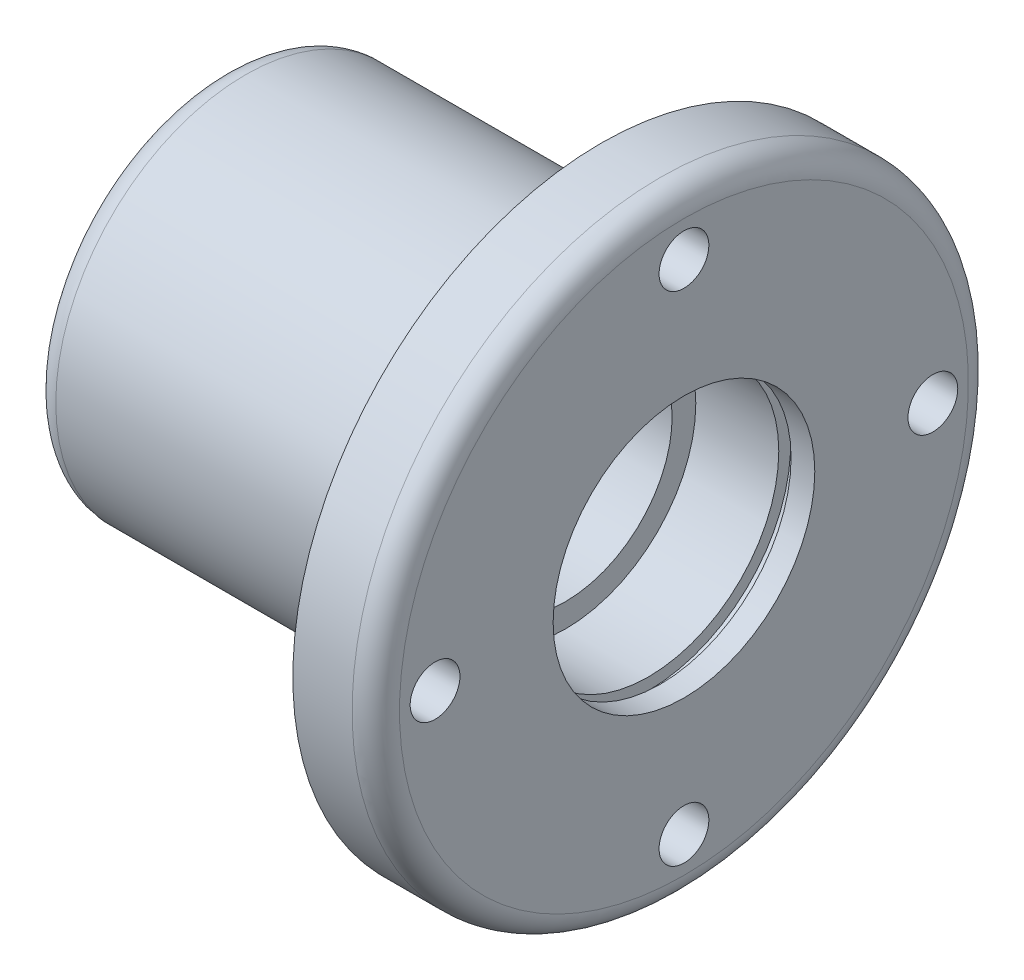
from build123d import *

# Parameters (mm, degrees)
SKETCH2_R          = 2.1
CUT_EXTRUDE1_DEPTH = 54.600373133
FILLET1_R          = 2


with BuildPart() as part:
    # Sketch1 → Revolve1 (revolve)
    with BuildSketch(Plane.XY, mode=Mode.PRIVATE) as revolve1_sk:
        Polygon((-70.7, 11), (-68.7, 11), (-68.7, 12), (-67.7, 12), (-67.7, 11), (-60.7, 11), (-60.7, 9), (-41.7, 9), (-41.7, 11), (-34.7, 11), (-34.7, 12), (-33.7, 12), (-33.7, 11.038518603), (-31.7, 11.038518603), (-31.7, 26), (-38.7, 26), (-38.7, 16), (-70.7, 16), align=None)
    revolve(revolve1_sk.sketch.rotate(Axis((-70.7, 0, 0), (1, 0, 0)), 180), axis=Axis((-70.7, 0, 0), (1, 0, 0)))

    # Sketch2 → Cut-Extrude1 (cut, through all)
    with BuildSketch(Plane(origin=(-31.7, 0, 0), x_dir=(0, 0, -1), z_dir=(1, 0, 0))):
        with Locations((0, 21)):
            Circle(SKETCH2_R)
        with Locations((21, 0)):
            Circle(SKETCH2_R)
        with Locations((0, -21)):
            Circle(SKETCH2_R)
        with Locations((-21, 0)):
            Circle(SKETCH2_R)
    extrude(amount=-CUT_EXTRUDE1_DEPTH, mode=Mode.SUBTRACT)

    # Fillet1
    fillet1_edges = [part.edges().sort_by_distance(p)[0] for p in [
        (-70.7, 16, 0),
        (-31.7, 26, 0),
    ]]
    fillet(fillet1_edges, radius=FILLET1_R)


solid = part.part
